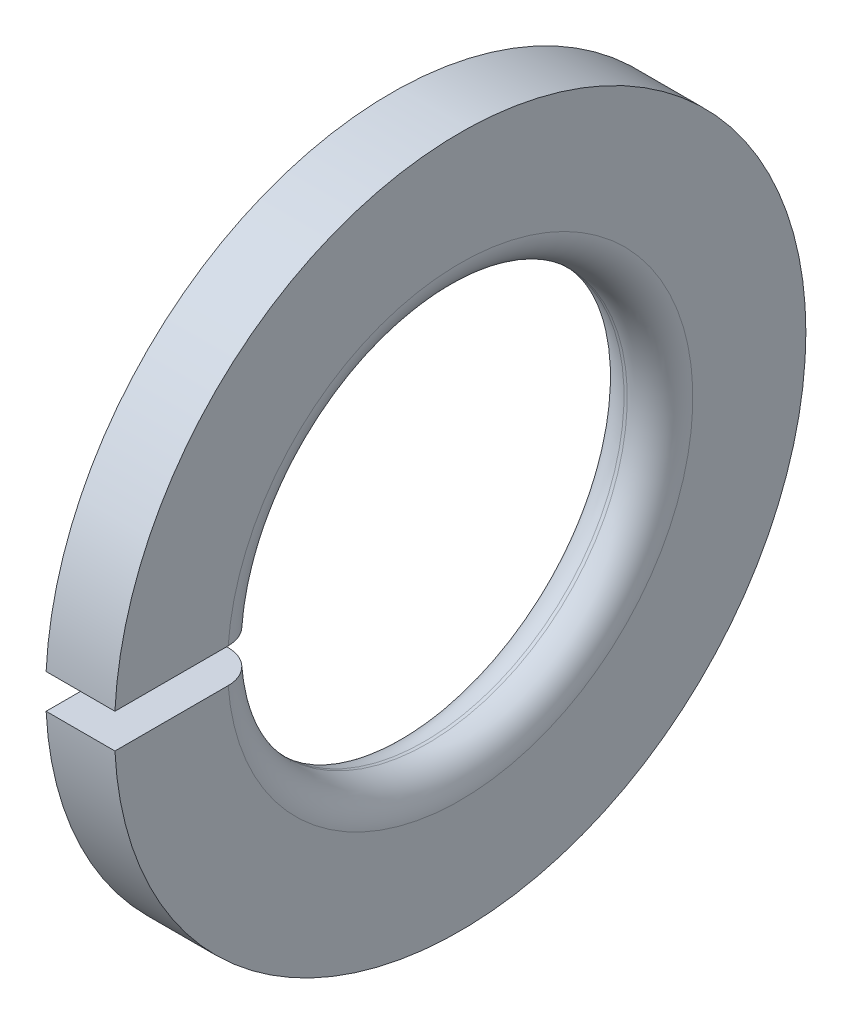
from build123d import *

# Parameters (mm, degrees)
SKETCH2_W = 1.05
SKETCH2_H = 10.761
GAP_DEPTH = 16.067016958


with BuildPart() as part:
    # Sketch1 → Base-Revolve (revolve)
    with BuildSketch(Plane.XY, mode=Mode.PRIVATE) as base_revolve_sk:
        with BuildLine():
            Line((0, 7.1), (0, 10.55))
            Line((0, 10.55), (-2.1, 10.55))
            Line((-2.1, 10.55), (-2.1, 7.1))
            ThreePointArc((-2.1, 7.1), (-1.807106781, 6.392893219), (-1.1, 6.1))
            Line((-1.1, 6.1), (-1, 6.1))
            ThreePointArc((-1, 6.1), (-0.292893219, 6.392893219), (0, 7.1))
        make_face()
    revolve(base_revolve_sk.sketch.rotate(Axis((-34.925, 0, 0), (1, 0, 0)), 90), axis=Axis((-34.925, 0, 0), (1, 0, 0)))

    # Sketch2 → Gap (cut, through all)
    with BuildSketch(Plane(origin=(0, 0, 0), x_dir=(0, -1, 0), z_dir=(-1, 0, 0))):
        with Locations((0, 5.3805)):
            Rectangle(SKETCH2_W, SKETCH2_H)
    extrude(amount=GAP_DEPTH, mode=Mode.SUBTRACT)


solid = part.part
